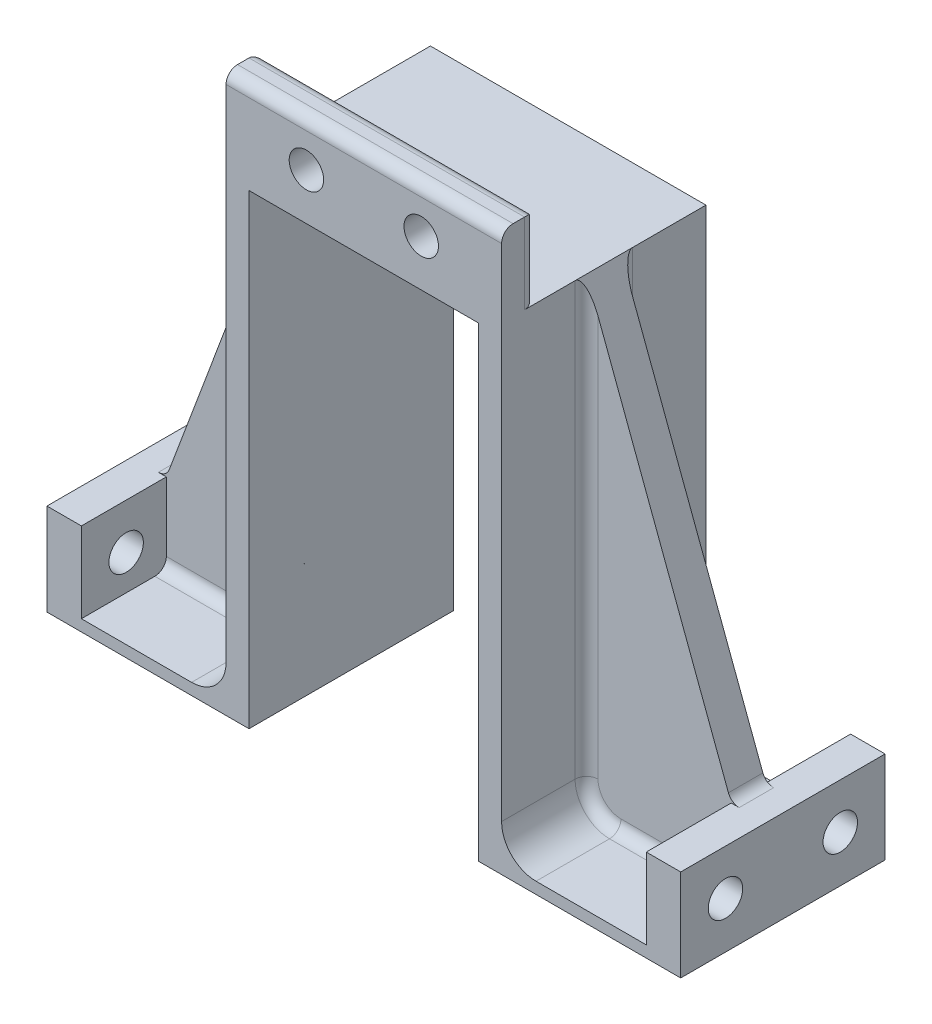
from build123d import *

# Parameters (mm, degrees)
BOSS_EXTRUDE1_DEPTH = 8.9
BOSS_EXTRUDE3_START = -8.9
SKETCH5_W           = 3
SKETCH5_H           = 7
BOSS_EXTRUDE3_DEPTH = 17.8
SKETCH9_W           = 24
SKETCH9_H           = 7
SKETCH9_R           = 1.5
BOSS_EXTRUDE4_DEPTH = 3
RIB2_REACH          = 51.893
SKETCH6_WALL_W      = 137.671187546
SKETCH6_WALL_H      = 3
SKETCH7_R           = 1.5
CUT_EXTRUDE2_DEPTH  = 3
FILLET1_R           = 3
FILLET2_R           = 1


with BuildPart() as part:
    # Sketch1 → Boss-Extrude1 (new, symmetric)
    with BuildSketch(Plane.XY):
        Polygon((-10, 0), (10, 0), (10, -40.6), (27.6, -40.6), (27.6, -39.6), (12, -39.6), (12, 1), (-12, 1), (-12, -39.6), (-27.6, -39.6), (-27.6, -40.6), (-10, -40.6), align=None)
    extrude(amount=BOSS_EXTRUDE1_DEPTH, both=True)

    # Sketch5 → Boss-Extrude3 (add)
    with BuildSketch(Plane.XY.offset(BOSS_EXTRUDE3_START)):
        with Locations((-26.1, -36.1)):
            Rectangle(SKETCH5_W, SKETCH5_H)
        with Locations((26.1, -36.1)):
            Rectangle(SKETCH5_W, SKETCH5_H)
    extrude(amount=BOSS_EXTRUDE3_DEPTH)

    # Sketch9 → Boss-Extrude4 (add)
    with BuildSketch(Plane.XY.offset(8.9)):
        with Locations((0, 4.5)):
            Rectangle(SKETCH9_W, SKETCH9_H)
        with Locations((-5, 4.05)):
            Circle(SKETCH9_R, mode=Mode.SUBTRACT)
        with Locations((5, 4.05)):
            Circle(SKETCH9_R, mode=Mode.SUBTRACT)
    extrude(amount=-BOSS_EXTRUDE4_DEPTH)

    # Sketch6 wall → Rib2 (add, up to next)
    with BuildSketch(Plane(origin=(-18.3, -15.8, 0), x_dir=(0.351123441588, 0.936329177569, 0), z_dir=(-0.936329177569, 0.351123441588, 0)), mode=Mode.PRIVATE) as rib2_sk1:
        Rectangle(SKETCH6_WALL_W, SKETCH6_WALL_H)
    rib2_tool1 = extrude(rib2_sk1.sketch, amount=-RIB2_REACH, mode=Mode.PRIVATE) - part.part
    rib2 = rib2_tool1.solids().sort_by_distance((-18.3, -15.8, 0))[0]
    add(rib2)

    # Mirror3: Rib2 across plane
    add(rib2.mirror(Plane(origin=(0, 0, 0), x_dir=(0, 0, 1), z_dir=(1, 0, 0))))

    # Sketch7 → Cut-Extrude2 (cut)
    with BuildSketch(Plane.ZY.offset(27.6)):
        with Locations((-5, -36.55)):
            Circle(SKETCH7_R)
        with Locations((5, -36.55)):
            Circle(SKETCH7_R)
    cut_extrude2 = extrude(amount=-CUT_EXTRUDE2_DEPTH, mode=Mode.SUBTRACT)

    # Mirror4: Cut-Extrude2 across plane
    add(cut_extrude2.mirror(Plane(origin=(0, 0, 0), x_dir=(0, 0, 1), z_dir=(1, 0, 0))), mode=Mode.SUBTRACT)

    # Fillet1
    fillet1_edges = [part.edges().sort_by_distance(p)[0] for p in [
        (12, -39.6, -5.2),
        (-12, -39.6, 5.2),
        (12, -39.6, 5.2),
        (-12, -39.6, -5.2),
    ]]
    fillet(fillet1_edges, radius=FILLET1_R)

    # Fillet2
    fillet2_edges = [part.edges().sort_by_distance(p)[0] for p in [
        (-12, -17.8, 1.5),
        (-12, -17.8, -1.5),
        (24.6, -32.6, 0),
        (19.8, -39.6, -1.5),
        (19.8, -39.6, 1.5),
        (-19.8, -39.6, -1.5),
        (-12.878679656, -38.721320344, -1.5),
        (-19.8, -39.6, 1.5),
        (-12.878679656, -38.721320344, 1.5),
        (12, -17.8, 1.5),
        (12.878679656, -38.721320344, 1.5),
        (12, -17.8, -1.5),
        (12.878679656, -38.721320344, -1.5),
        (12, 4.5, 5.9),
        (-12, 4.5, 5.9),
        (0, 8, 5.9),
        (0, 8, 8.9),
        (-24.6, -32.6, 0),
    ]]
    fillet(fillet2_edges, radius=FILLET2_R)


solid = part.part
